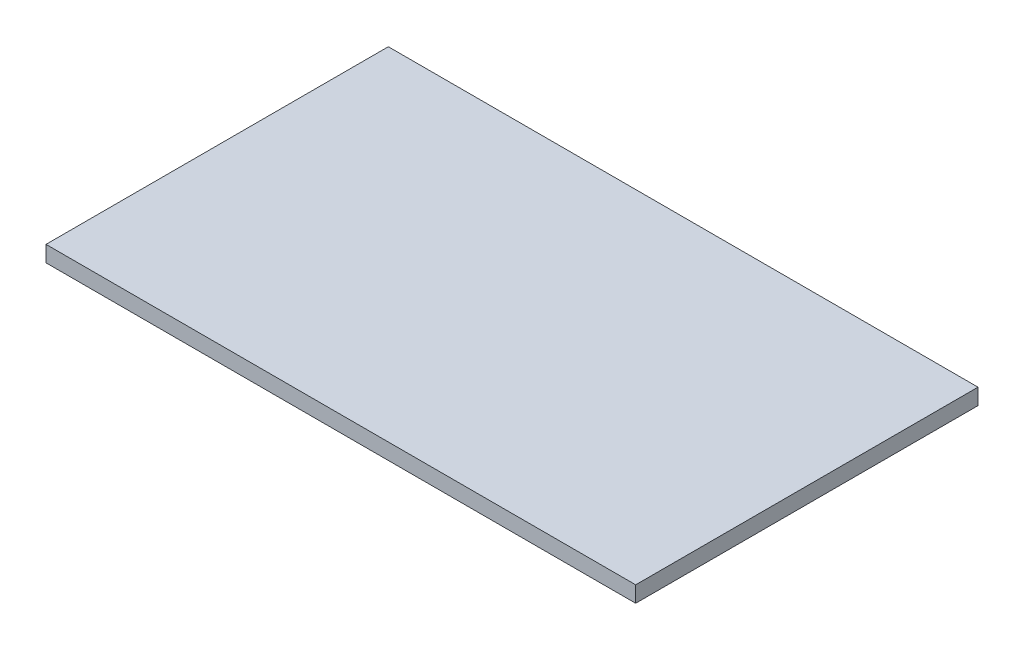
from build123d import *

# Parameters (mm, degrees)
SKETCH1_W           = 26.7
SKETCH1_H           = 15.5
BOSS_EXTRUDE1_DEPTH = 0.725


with BuildPart() as part:
    # Sketch1 → Boss-Extrude1 (new body)
    with BuildSketch(Plane(origin=(0, 0, 0), x_dir=(1, 0, 0), z_dir=(0, 1, 0))):
        with Locations((-13.35, 7.75)):
            Rectangle(SKETCH1_W, SKETCH1_H)
    extrude(amount=BOSS_EXTRUDE1_DEPTH)


solid = part.part
